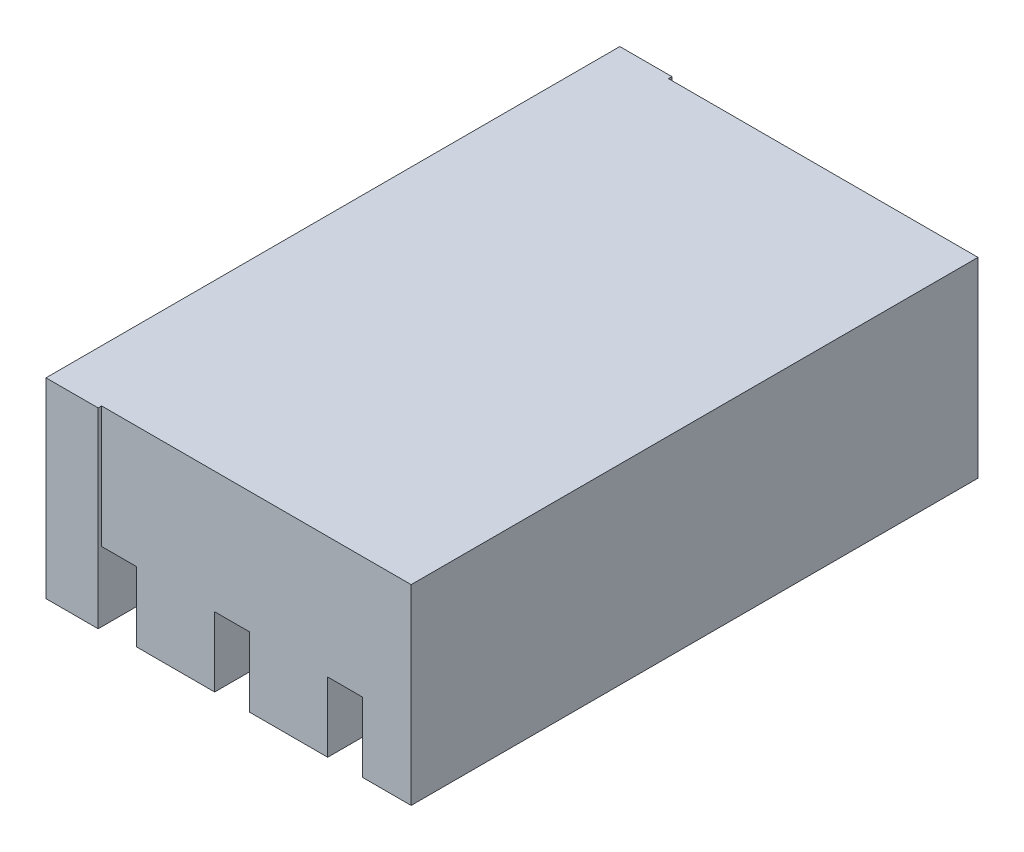
from build123d import *

# Parameters (mm, degrees)
BOSS_EXTRUDE1_DEPTH     = 11
SKETCH2_W               = 21
SKETCH2_H               = 33
BOSS_EXTRUDE2_DEPTH     = 3
SKETCH3_W               = 2
SKETCH3_H               = 4.664590192
SKETCH3_H_2             = 8.385591547
SKETCH3_H_3             = 5.091451809
CUT_EXTRUDE1_DEPTH      = 4
CUT_EXTRUDE2_REACH      = 25.564
SKETCH4_W               = 15.2
SKETCH4_H               = 30
CUT_EXTRUDE3_DEPTH      = 24.563743336
CUT_EXTRUDE3_DEPTH_BACK = 24.563743336
SKETCH4_3_W             = 43.430774682
SKETCH4_3_H             = 55.651594456


with BuildPart() as part:
    # Sketch1 → Boss-Extrude1 (new body)
    with BuildSketch(Plane(origin=(0, 0, 0), x_dir=(1, 0, 0), z_dir=(0, 1, 0))):
        Polygon((10.5, 15), (7.5, 15), (7.5, -15), (-7.5, -15), (-7.5, 15), (-10.5, 15), (-10.5, -18), (10.5, -18), align=None)
    extrude(amount=BOSS_EXTRUDE1_DEPTH)

    # Sketch2 → Boss-Extrude2 (add)
    with BuildSketch(Plane(origin=(0, 11, 0), x_dir=(1, 0, 0), z_dir=(0, 1, 0))):
        with Locations((0, -1.5)):
            Rectangle(SKETCH2_W, SKETCH2_H)
    extrude(amount=-BOSS_EXTRUDE2_DEPTH)

    # Sketch3 → Cut-Extrude1 (cut)
    with BuildSketch(Plane.XZ):
        with Locations((-6.5, 17.332295096)):
            Rectangle(SKETCH3_W, SKETCH3_H)
        with Locations((0, 19.192795774)):
            Rectangle(SKETCH3_W, SKETCH3_H_2)
        with Locations((6.5, 17.545725905)):
            Rectangle(SKETCH3_W, SKETCH3_H_3)
    extrude(amount=-CUT_EXTRUDE1_DEPTH, mode=Mode.SUBTRACT)

    # Cut-Extrude2: up to this face of the body (flat: up to its plane)
    cut_extrude2_end = Plane(part.part.faces().sort_by_distance((0, 8, 0))[0])
    # Sketch4 → Cut-Extrude2 (cut, up to the picked face)
    with BuildSketch(Plane.XZ, mode=Mode.PRIVATE) as cut_extrude2_sk1:
        with Locations((0.1, 0.2)):
            Rectangle(SKETCH4_W, SKETCH4_H)
    cut_extrude2_tool1 = split(extrude(cut_extrude2_sk1.sketch, amount=-CUT_EXTRUDE2_REACH, mode=Mode.PRIVATE), bisect_by=cut_extrude2_end, keep=Keep.BOTH, mode=Mode.PRIVATE)
    add(cut_extrude2_tool1.solids().sort_by(Axis((0.1, 0, 0.2), (0, 1, 0)))[0], mode=Mode.SUBTRACT)

    # Sketch4<3> → Cut-Extrude3 (cut, two sides: drawn at the far end of the back side and taken through both)
    with BuildSketch(Plane.XZ.offset(-CUT_EXTRUDE3_DEPTH_BACK)):
        Rectangle(SKETCH4_3_W, SKETCH4_3_H)
        Polygon((10.3, -14.8), (7.7, -14.8), (-7.5, -14.8), (-7.5, -15), (-10.5, -15), (-10.5, 18), (-7.5, 18), (-7.5, 17.8), (-5.5, 17.8), (-1, 17.8), (1, 17.8), (5.5, 17.8), (7.5, 17.8), (10.3, 17.8), align=None, mode=Mode.SUBTRACT)
    extrude(amount=CUT_EXTRUDE3_DEPTH + CUT_EXTRUDE3_DEPTH_BACK, mode=Mode.SUBTRACT)


solid = part.part
